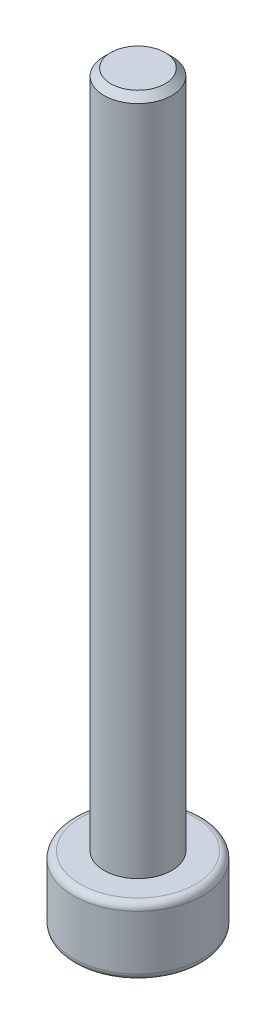
from build123d import *

# Parameters (mm, degrees)
SKETCH_1_R          = 2.85
EXTRUDE_1_DEPTH     = 3
SKETCH_2_R          = 1.5
EXTRUDE_2_DEPTH     = 30
SKETCH_3_R          = 1.29
CUT_EXTRUDE_1_DEPTH = 1.3
FILLET_1_R          = 0.3
CHAMFER_1_SIZE      = 0.3
CHAMFER_2_SIZE      = 0.15


with BuildPart() as part:
    # 草图1 → 凸台-拉伸1 (new body)
    with BuildSketch(Plane(origin=(0, 0, 0), x_dir=(1, 0, 0), z_dir=(0, 1, 0))):
        with Locations(Location((0, 0, 0), (0, 0, 270))):
            Circle(SKETCH_1_R)
    extrude(amount=EXTRUDE_1_DEPTH)

    # 草图2 → 凸台-拉伸2 (add)
    with BuildSketch(Plane(origin=(0, 3, 0), x_dir=(1, 0, 0), z_dir=(0, 1, 0))):
        with Locations(Location((0, 0, 0), (0, 0, 270))):
            Circle(SKETCH_2_R)
    extrude(amount=EXTRUDE_2_DEPTH)

    # 草图3 → 切除-拉伸1 (cut)
    with BuildSketch(Plane.XZ):
        with Locations(Location((0, 0, 0), (0, 0, 270))):
            Circle(SKETCH_3_R)
    extrude(amount=-CUT_EXTRUDE_1_DEPTH, mode=Mode.SUBTRACT)

    # 圆角1
    fillet_1_edges = [part.edges().sort_by_distance(p)[0] for p in [
        (0, 0, -2.85),
        (0, 3, -2.85),
    ]]
    fillet(fillet_1_edges, radius=FILLET_1_R)

    # 倒角1
    chamfer_1_edges = [part.edges().sort_by_distance(p)[0] for p in [
        (0, 33, -1.5),
    ]]
    chamfer(chamfer_1_edges, length=CHAMFER_1_SIZE)

    # 倒角2
    chamfer_2_edges = [part.edges().sort_by_distance(p)[0] for p in [
        (0, 0, 1.29),
    ]]
    chamfer(chamfer_2_edges, length=CHAMFER_2_SIZE)


solid = part.part
